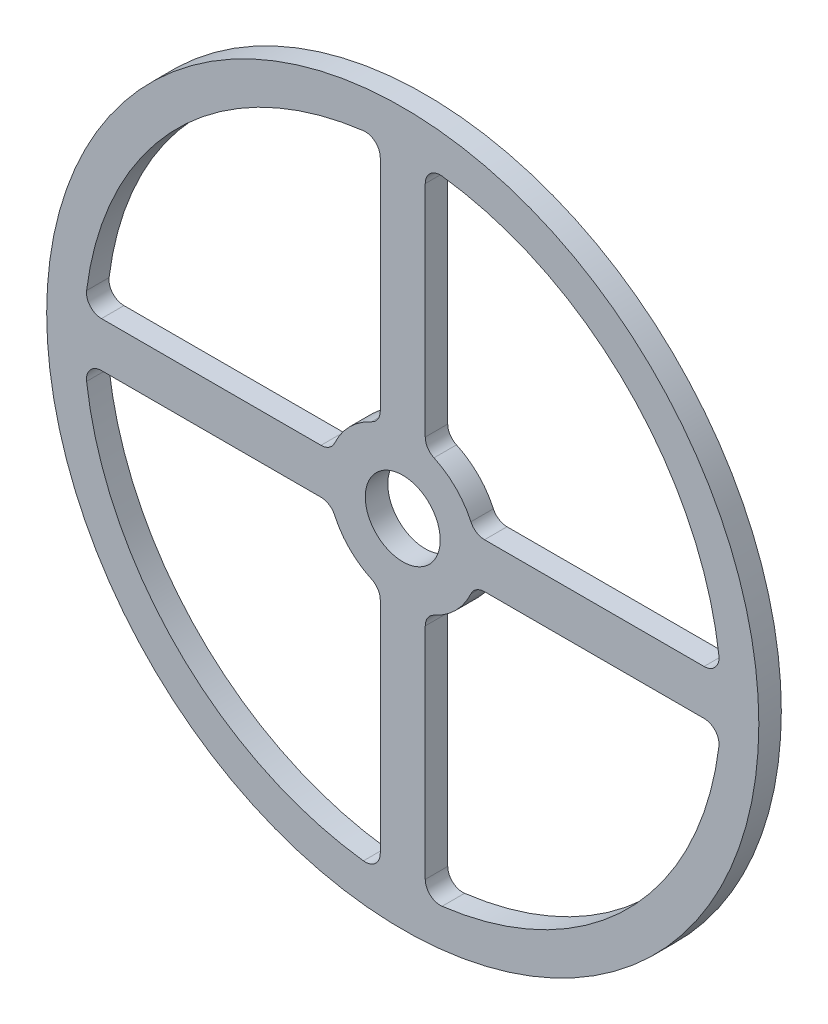
from build123d import *

# Parameters (mm, degrees)
SKETCH_1_R      = 47.5
SKETCH_1_R_2    = 5
EXTRUDE_1_DEPTH = 3
FILLET_1_R      = 2
FILLET_2_R      = 2
FILLET_4_R      = 2


with BuildPart() as part:
    # 草图1 → 凸台-拉伸1 (new body)
    with BuildSketch(Plane.XY):
        Circle(SKETCH_1_R)
        Circle(SKETCH_1_R_2, mode=Mode.SUBTRACT)
        with BuildLine():
            Line((3, 42.393985422), (3, 9.539392014))
            ThreePointArc((3, 9.539392014), (7.071067812, 7.071067812), (9.539392014, 3))
            Line((9.539392014, 3), (42.393985422, 3))
            ThreePointArc((42.393985422, 3), (30.0520382, 30.0520382), (3, 42.393985422))
        make_face(mode=Mode.SUBTRACT)
        with BuildLine():
            Line((-9.539392014, -3), (-42.393985422, -3))
            ThreePointArc((-42.393985422, -3), (-30.0520382, -30.0520382), (-3, -42.393985422))
            Line((-3, -42.393985422), (-3, -9.539392014))
            ThreePointArc((-3, -9.539392014), (-7.071067812, -7.071067812), (-9.539392014, -3))
        make_face(mode=Mode.SUBTRACT)
        with BuildLine():
            Line((9.539392014, -3), (42.393985422, -3))
            ThreePointArc((42.393985422, -3), (30.0520382, -30.0520382), (3, -42.393985422))
            Line((3, -42.393985422), (3, -9.539392014))
            ThreePointArc((3, -9.539392014), (7.071067812, -7.071067812), (9.539392014, -3))
        make_face(mode=Mode.SUBTRACT)
        with BuildLine():
            Line((-3, 9.539392014), (-3, 42.393985422))
            ThreePointArc((-3, 42.393985422), (-30.0520382, 30.0520382), (-42.393985422, 3))
            Line((-42.393985422, 3), (-9.539392014, 3))
            ThreePointArc((-9.539392014, 3), (-7.071067812, 7.071067812), (-3, 9.539392014))
        make_face(mode=Mode.SUBTRACT)
    extrude(amount=EXTRUDE_1_DEPTH)

    # 圆角1
    fillet_1_edges = [part.edges().sort_by_distance(p)[0] for p in [
        (3, 42.393985422, 1.5),
    ]]
    fillet(fillet_1_edges, radius=FILLET_1_R)

    # 圆角2
    fillet_2_edges = [part.edges().sort_by_distance(p)[0] for p in [
        (42.393985422, 3, 1.5),
        (3, -42.393985422, 1.5),
        (42.393985422, -3, 1.5),
        (-42.393985422, -3, 1.5),
        (-3, -42.393985422, 1.5),
        (-3, 42.393985422, 1.5),
        (-42.393985422, 3, 1.5),
    ]]
    fillet(fillet_2_edges, radius=FILLET_2_R)

    # 圆角4
    fillet_4_edges = [part.edges().sort_by_distance(p)[0] for p in [
        (3, 9.539392014, 1.5),
        (9.539392014, 3, 1.5),
        (9.539392014, -3, 1.5),
        (3, -9.539392014, 1.5),
        (-3, -9.539392014, 1.5),
        (-9.539392014, -3, 1.5),
        (-9.539392014, 3, 1.5),
        (-3, 9.539392014, 1.5),
    ]]
    fillet(fillet_4_edges, radius=FILLET_4_R)


solid = part.part
